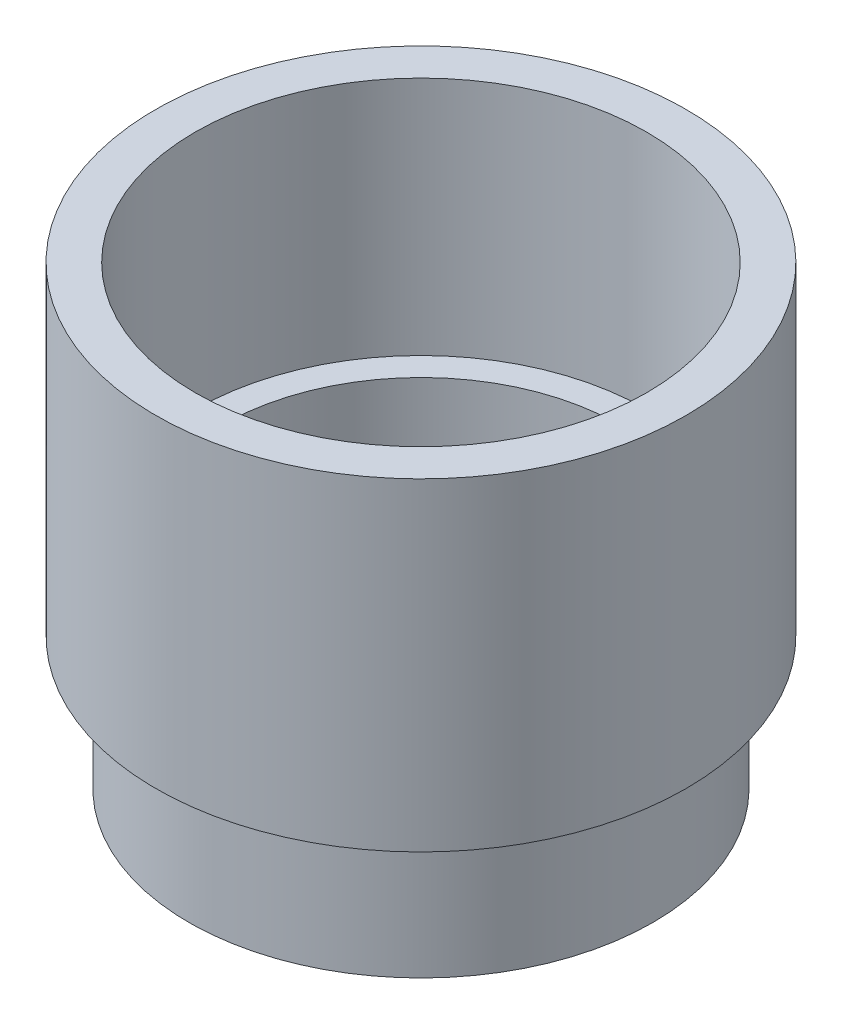
from build123d import *


with BuildPart() as part:
    # 草图1 → 旋转1 (revolve)
    with BuildSketch(Plane.XY):
        Polygon((24, 0), (28, 0), (28, 16), (32, 16), (32, 55), (27.25, 55), (27.25, 26), (24, 26), align=None)
    revolve(axis=Axis((0, -1000, 0), (0, 1, 0)))


solid = part.part
